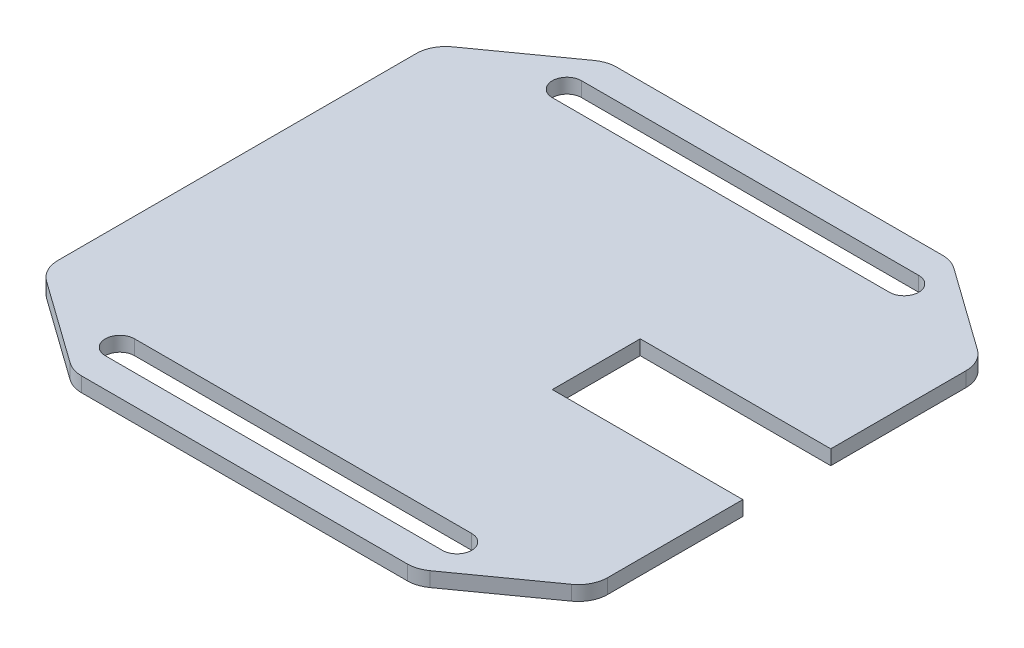
from build123d import *

# Parameters (mm, degrees)
SKETCH_1_W          = 37.5
SKETCH_1_H          = 36.5
EXTRUDE_1_DEPTH     = 1
CUT_EXTRUDE_1_DEPTH = 1
CUT_EXTRUDE_2_DEPTH = 1
FILLET_1_R          = 2
SKETCH_4_W          = 13
SKETCH_4_H          = 6
CUT_EXTRUDE_3_DEPTH = 1


with BuildPart() as part:
    # 草图1 → 凸台-拉伸1 (new body)
    with BuildSketch(Plane(origin=(0, 0, 0), x_dir=(1, 0, 0), z_dir=(0, 1, 0))):
        Rectangle(SKETCH_1_W, SKETCH_1_H)
    extrude(amount=EXTRUDE_1_DEPTH)

    # 草图2 → 切除-拉伸1 (cut)
    with BuildSketch(Plane(origin=(0, 1, 0), x_dir=(1, 0, 0), z_dir=(0, 1, 0))):
        Polygon((-11.75, 18.25), (-18.75, 13.25), (-18.75, 18.25), align=None)
        Polygon((18.75, 18.25), (11.75, 18.25), (18.75, 13.25), align=None)
        Polygon((11.75, -18.25), (18.75, -13.25), (18.75, -18.25), align=None)
        Polygon((-18.75, -18.25), (-11.75, -18.25), (-18.75, -13.25), align=None)
    extrude(amount=-CUT_EXTRUDE_1_DEPTH, mode=Mode.SUBTRACT)

    # 草图3 → 切除-拉伸2 (cut)
    with BuildSketch(Plane(origin=(0, 1, 0), x_dir=(1, 0, 0), z_dir=(0, 1, 0))):
        with BuildLine():
            Line((-11.5, 16.25), (11.5, 16.25))
            ThreePointArc((11.5, 16.25), (12.5, 15.25), (11.5, 14.25))
            Line((11.5, 14.25), (-11.5, 14.25))
            ThreePointArc((-11.5, 14.25), (-12.5, 15.25), (-11.5, 16.25))
        make_face()
        with BuildLine():
            Line((-11.5, -16.25), (11.5, -16.25))
            ThreePointArc((11.5, -16.25), (12.5, -15.25), (11.5, -14.25))
            Line((11.5, -14.25), (-11.5, -14.25))
            ThreePointArc((-11.5, -14.25), (-12.5, -15.25), (-11.5, -16.25))
        make_face()
    extrude(amount=-CUT_EXTRUDE_2_DEPTH, mode=Mode.SUBTRACT)

    # 圆角1
    fillet_1_edges = [part.edges().sort_by_distance(p)[0] for p in [
        (-18.75, 0.5, 13.25),
        (-11.75, 0.5, 18.25),
        (11.75, 0.5, 18.25),
        (18.75, 0.5, 13.25),
        (18.75, 0.5, -13.25),
        (11.75, 0.5, -18.25),
        (-11.75, 0.5, -18.25),
        (-18.75, 0.5, -13.25),
    ]]
    fillet(fillet_1_edges, radius=FILLET_1_R)

    # 草图4 → 切除-拉伸3 (cut)
    with BuildSketch(Plane(origin=(0, 1, 0), x_dir=(1, 0, 0), z_dir=(0, 1, 0))):
        with Locations((12.25, 0)):
            Rectangle(SKETCH_4_W, SKETCH_4_H)
    extrude(amount=-CUT_EXTRUDE_3_DEPTH, mode=Mode.SUBTRACT)


solid = part.part
